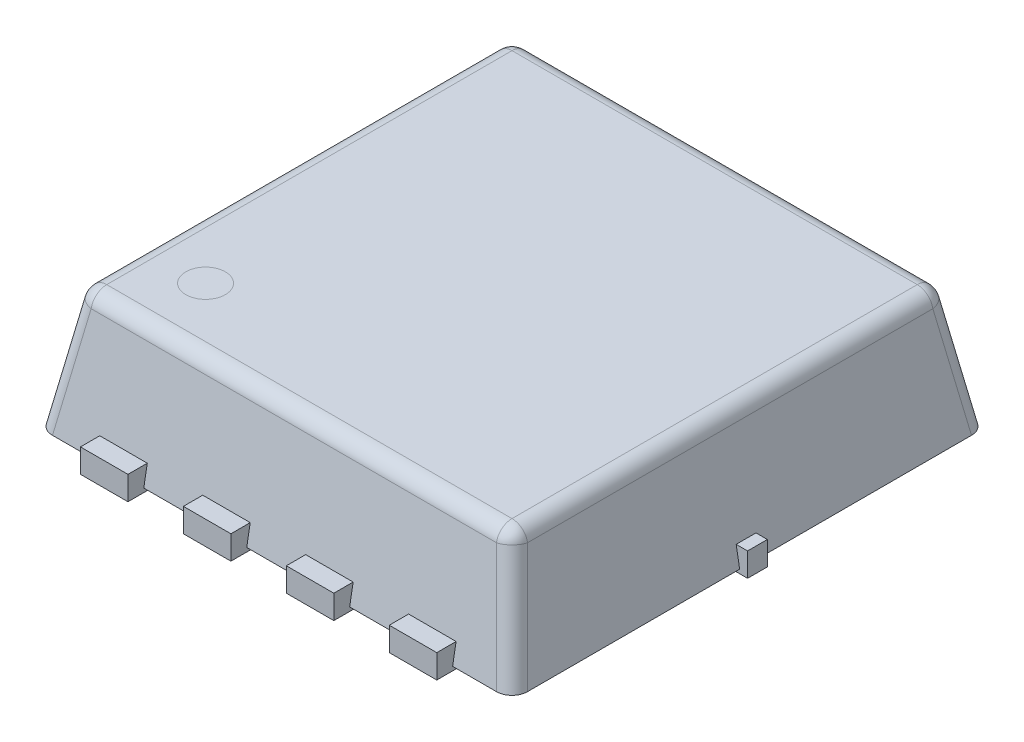
from build123d import *

# Parameters (mm, degrees)
EXTRUDE_START       = 0.025
SKETCH_1_W          = 3
SKETCH_1_H          = 3
EXTRUDE_1_DEPTH     = 0.775
EXTRUDE_1_TAPER     = 10
FILLET_1_R          = 0.1
SKETCH_2_W          = 0.3
SKETCH_2_H          = 0.4
CUT_EXTRUDE_1_DEPTH = 0.15
SKETCH_2_2_W        = 0.3
SKETCH_2_2_H        = 0.4
EXTRUDE_2_DEPTH     = 0.15
EXTRUDE_2_2_DEPTH   = 0.15
EXTRUDE_2_3_DEPTH   = 0.15
EXTRUDE_2_4_DEPTH   = 0.15
EXTRUDE_2_5_DEPTH   = 0.15
CUT_EXTRUDE_START   = 0.8
SKETCH_3_R          = 0.125
CUT_EXTRUDE_2_DEPTH = 0.05
EXTRUDE_START_2     = 0.8
SKETCH_3_2_R        = 0.125
EXTRUDE_3_DEPTH     = 0.05


with BuildPart() as part:
    # Эскиз1 → Бобышка-Вытянуть1 (new body)
    with BuildSketch(Plane(origin=(0, 0, 0), x_dir=(1, 0, 0), z_dir=(0, 1, 0)).offset(EXTRUDE_START)):
        Rectangle(SKETCH_1_W, SKETCH_1_H)
    extrude(amount=EXTRUDE_1_DEPTH, taper=EXTRUDE_1_TAPER)

    # Скругление1
    fillet_1_edges = [part.edges().sort_by_distance(p)[0] for p in [
        (1.431673295, 0.4125, -1.431673295),
        (-1.431673295, 0.4125, -1.431673295),
        (-1.36334659, 0.8, 0),
        (0, 0.8, -1.36334659),
        (1.36334659, 0.8, 0),
        (1.431673295, 0.4125, 1.431673295),
        (0, 0.8, 1.36334659),
        (-1.431673295, 0.4125, 1.431673295),
    ]]
    fillet(fillet_1_edges, radius=FILLET_1_R)

    # Эскиз2 → Вырез-Вытянуть1 (cut)
    with BuildSketch(Plane(origin=(0, 0, 0), x_dir=(1, 0, 0), z_dir=(0, 1, 0))):
        with Locations((-0.325, -1.4)):
            Rectangle(SKETCH_2_W, SKETCH_2_H)
        with Locations((-0.975, -1.4)):
            Rectangle(SKETCH_2_W, SKETCH_2_H)
        with Locations((0.325, -1.4)):
            Rectangle(SKETCH_2_W, SKETCH_2_H)
        with Locations((0.975, -1.4)):
            Rectangle(SKETCH_2_W, SKETCH_2_H)
        Polygon((-0.175, 1.3), (-0.175, 1.6), (-0.475, 1.6), (-0.475, 1.3), (-0.525, 1.3), (-0.525, 1.17), (-0.775, 1.17), (-0.775, 1.3), (-0.825, 1.3), (-0.825, 1.6), (-1.125, 1.6), (-1.125, 1.3), (-1.175, 1.3), (-1.175, 1.17), (-1.175, 0.165), (-1.3, 0.165), (-1.3, 0.0625), (-1.55, 0.0625), (-1.55, -0.0625), (-1.3, -0.0625), (-1.3, -0.165), (-1.175, -0.165), (-1.175, -0.58), (1.175, -0.58), (1.175, -0.165), (1.3, -0.165), (1.3, -0.0625), (1.55, -0.0625), (1.55, 0.0625), (1.3, 0.0625), (1.3, 0.165), (1.175, 0.165), (1.175, 1.17), (1.175, 1.3), (1.125, 1.3), (1.125, 1.6), (0.825, 1.6), (0.825, 1.3), (0.775, 1.3), (0.775, 1.17), (0.525, 1.17), (0.525, 1.3), (0.475, 1.3), (0.475, 1.6), (0.175, 1.6), (0.175, 1.3), (0.125, 1.3), (0.125, 1.17), (-0.125, 1.17), (-0.125, 1.3), align=None)
    extrude(amount=CUT_EXTRUDE_1_DEPTH, mode=Mode.SUBTRACT)

    # Эскиз3 → Вырез-Вытянуть2 (cut)
    with BuildSketch(Plane(origin=(0, 0, 0), x_dir=(1, 0, 0), z_dir=(0, 1, 0)).offset(CUT_EXTRUDE_START)):
        with Locations((-0.975, -0.96)):
            Circle(SKETCH_3_R)
    extrude(amount=-CUT_EXTRUDE_2_DEPTH, mode=Mode.SUBTRACT)


with BuildPart() as body_2:
    # Эскиз2<2> → Бобышка-Вытянуть2 (new body)
    with BuildSketch(Plane(origin=(0, 0, 0), x_dir=(1, 0, 0), z_dir=(0, 1, 0))):
        with Locations((-0.325, -1.4)):
            Rectangle(SKETCH_2_2_W, SKETCH_2_2_H)
    extrude(amount=EXTRUDE_2_DEPTH)


with BuildPart() as body_3:
    # Эскиз2<2> → Extrude 2 2 (new body)
    with BuildSketch(Plane(origin=(0, 0, 0), x_dir=(1, 0, 0), z_dir=(0, 1, 0))):
        with Locations((-0.975, -1.4)):
            Rectangle(SKETCH_2_2_W, SKETCH_2_2_H)
    extrude(amount=EXTRUDE_2_2_DEPTH)


with BuildPart() as body_4:
    # Эскиз2<2> → Extrude 2 3 (new body)
    with BuildSketch(Plane(origin=(0, 0, 0), x_dir=(1, 0, 0), z_dir=(0, 1, 0))):
        with Locations((0.325, -1.4)):
            Rectangle(SKETCH_2_2_W, SKETCH_2_2_H)
    extrude(amount=EXTRUDE_2_3_DEPTH)


with BuildPart() as body_5:
    # Эскиз2<2> → Extrude 2 4 (new body)
    with BuildSketch(Plane(origin=(0, 0, 0), x_dir=(1, 0, 0), z_dir=(0, 1, 0))):
        with Locations((0.975, -1.4)):
            Rectangle(SKETCH_2_2_W, SKETCH_2_2_H)
    extrude(amount=EXTRUDE_2_4_DEPTH)


with BuildPart() as body_6:
    # Эскиз2<2> → Extrude 2 5 (new body)
    with BuildSketch(Plane(origin=(0, 0, 0), x_dir=(1, 0, 0), z_dir=(0, 1, 0))):
        Polygon((-0.175, 1.3), (-0.175, 1.6), (-0.475, 1.6), (-0.475, 1.3), (-0.525, 1.3), (-0.525, 1.17), (-0.775, 1.17), (-0.775, 1.3), (-0.825, 1.3), (-0.825, 1.6), (-1.125, 1.6), (-1.125, 1.3), (-1.175, 1.3), (-1.175, 1.17), (-1.175, 0.165), (-1.3, 0.165), (-1.3, 0.0625), (-1.55, 0.0625), (-1.55, -0.0625), (-1.3, -0.0625), (-1.3, -0.165), (-1.175, -0.165), (-1.175, -0.58), (1.175, -0.58), (1.175, -0.165), (1.3, -0.165), (1.3, -0.0625), (1.55, -0.0625), (1.55, 0.0625), (1.3, 0.0625), (1.3, 0.165), (1.175, 0.165), (1.175, 1.17), (1.175, 1.3), (1.125, 1.3), (1.125, 1.6), (0.825, 1.6), (0.825, 1.3), (0.775, 1.3), (0.775, 1.17), (0.525, 1.17), (0.525, 1.3), (0.475, 1.3), (0.475, 1.6), (0.175, 1.6), (0.175, 1.3), (0.125, 1.3), (0.125, 1.17), (-0.125, 1.17), (-0.125, 1.3), align=None)
    extrude(amount=EXTRUDE_2_5_DEPTH)


with BuildPart() as body_7:
    # Эскиз3<2> → Бобышка-Вытянуть3 (new body)
    with BuildSketch(Plane(origin=(0, 0, 0), x_dir=(1, 0, 0), z_dir=(0, 1, 0)).offset(EXTRUDE_START_2)):
        with Locations((-0.975, -0.96)):
            Circle(SKETCH_3_2_R)
    extrude(amount=-EXTRUDE_3_DEPTH)


solid = Compound([part.part, body_2.part, body_3.part, body_4.part, body_5.part, body_6.part, body_7.part])
